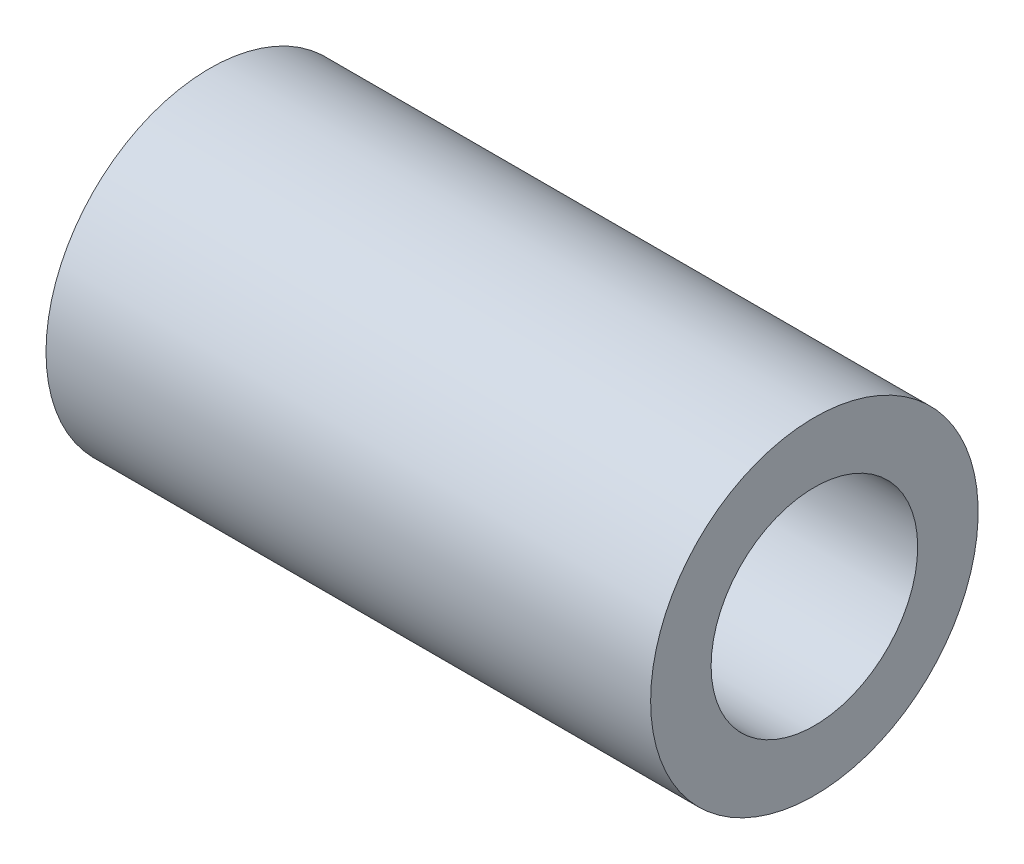
from build123d import *


with BuildPart() as part:
    # Esboço1 → Revolução1 (revolve)
    with BuildSketch(Plane(origin=(0, 0, 0), x_dir=(1, 0, 0), z_dir=(0, 1, 0)), mode=Mode.PRIVATE) as revolu_o1_sk:
        Polygon((12, 2.05), (12, 3.25), (0, 3.25), (0, 2.35), (8, 2.35), (8, 2.05), align=None)
    revolve(revolu_o1_sk.sketch.rotate(Axis((0, 0, 0), (1, 0, 0)), 180), axis=Axis((0, 0, 0), (1, 0, 0)))


solid = part.part
